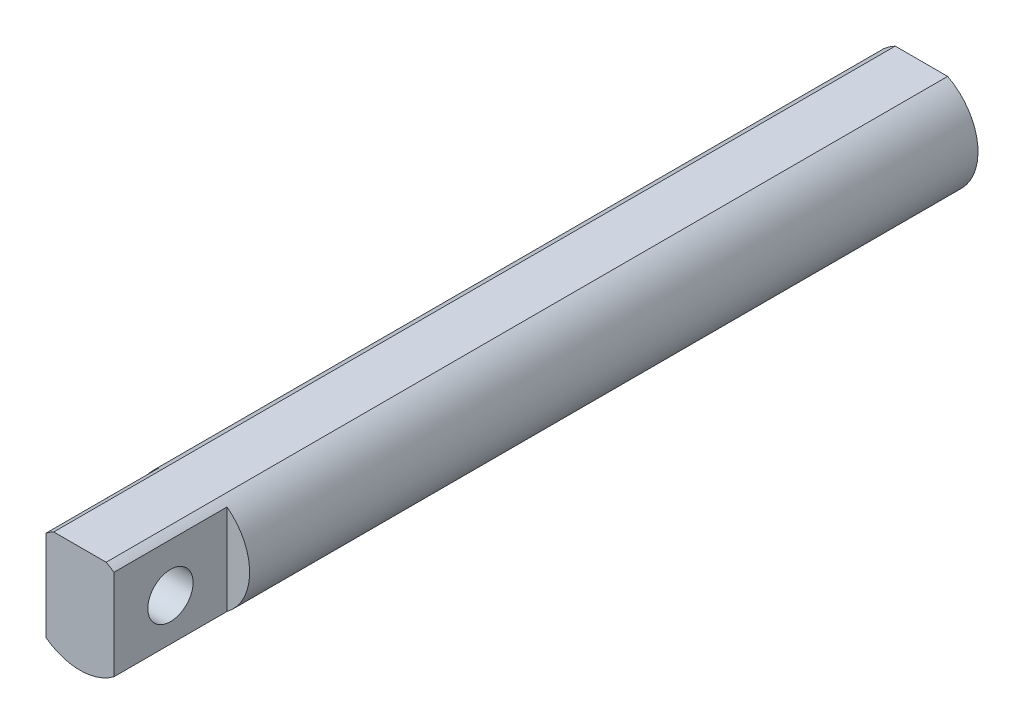
from build123d import *

# Parameters (mm, degrees)
CROQUIS1_R              = 10
SALIENTE_EXTRUIR1_DEPTH = 148.75
CROQUIS2_W              = 8.300476758
CROQUIS2_H              = 25.089011669
CROQUIS2_W_2            = 8.253581409
CROQUIS2_H_2            = 26.542767485
CORTAR_EXTRUIR1_DEPTH   = 20
CROQUIS3_W              = 10.62874173
CROQUIS3_H              = 2.099903381
CORTAR_EXTRUIR2_DEPTH   = 220
CROQUIS4_R              = 4
CORTAR_EXTRUIR3_DEPTH   = 150.941863734


with BuildPart() as part:
    # Croquis1 → Saliente-Extruir1 (new body)
    with BuildSketch(Plane.XY):
        Circle(CROQUIS1_R)
    extrude(amount=SALIENTE_EXTRUIR1_DEPTH)

    # Croquis2 → Cortar-Extruir1 (cut)
    with BuildSketch(Plane.XY.offset(148.75)):
        with Locations((-10.150238379, -0.750325583)):
            Rectangle(CROQUIS2_W, CROQUIS2_H)
        with Locations((10.126790704, -1.102040699)):
            Rectangle(CROQUIS2_W_2, CROQUIS2_H_2)
    extrude(amount=-CORTAR_EXTRUIR1_DEPTH, mode=Mode.SUBTRACT)

    # Croquis3 → Cortar-Extruir2 (cut)
    with BuildSketch(Plane.XY.offset(148.75)):
        with Locations((-0.162613374, 9.911313118)):
            Rectangle(CROQUIS3_W, CROQUIS3_H)
    extrude(amount=-CORTAR_EXTRUIR2_DEPTH, mode=Mode.SUBTRACT)

    # Croquis4 → Cortar-Extruir3 (cut, through all)
    with BuildSketch(Plane.ZY.offset(6)):
        with Locations(Location((138.75, -0.552617742, 0), (0, 0, 270))):
            Circle(CROQUIS4_R)
    extrude(amount=-CORTAR_EXTRUIR3_DEPTH, mode=Mode.SUBTRACT)


solid = part.part
